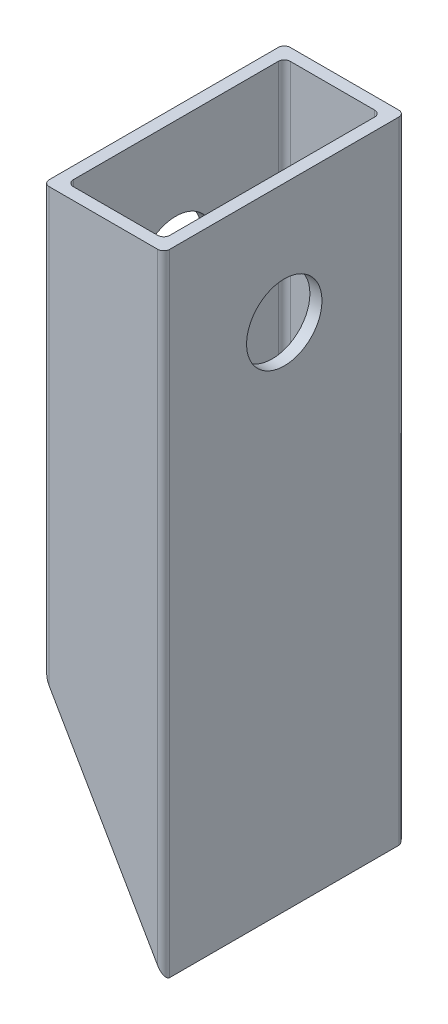
from build123d import *

# Parameters (mm, degrees)
BOSS_EXTRU_1_DEPTH      = 705
ESQUISSE3_R             = 10.125
ESQUISSE3_R_2           = 12.5
ENL_V_MAT_EXTRU_1_DEPTH = 711.651109899
ENL_V_MAT_EXTRU_2_DEPTH = 711.651109899


with BuildPart() as part:
    # Esquisse2 → Boss.-Extru.1 (new body)
    with BuildSketch(Plane(origin=(0, 0, 0), x_dir=(1, 0, 0), z_dir=(0, 1, 0))):
        with BuildLine():
            Line((2, 0), (38, 0))
            ThreePointArc((38, 0), (39.414213562, 0.585786438), (40, 2))
            Line((40, 2), (40, 78))
            ThreePointArc((40, 78), (39.414213562, 79.414213562), (38, 80))
            Line((38, 80), (2, 80))
            ThreePointArc((2, 80), (0.585786438, 79.414213562), (0, 78))
            Line((0, 78), (0, 2))
            ThreePointArc((0, 2), (0.585786438, 0.585786438), (2, 0))
        make_face()
        with BuildLine():
            Line((6, 4), (34, 4))
            ThreePointArc((34, 4), (35.414213562, 4.585786438), (36, 6))
            Line((36, 6), (36, 74))
            ThreePointArc((36, 74), (35.414213562, 75.414213562), (34, 76))
            Line((34, 76), (6, 76))
            ThreePointArc((6, 76), (4.585786438, 75.414213562), (4, 74))
            Line((4, 74), (4, 6))
            ThreePointArc((4, 6), (4.585786438, 4.585786438), (6, 4))
        make_face(mode=Mode.SUBTRACT)
    extrude(amount=BOSS_EXTRU_1_DEPTH)

    # Esquisse3 → Enlèv. mat.-Extru.1 (cut, through all)
    with BuildSketch(Plane(origin=(40, 0, 0), x_dir=(0, 0, -1), z_dir=(1, 0, 0))):
        with Locations((40, 90)):
            Circle(ESQUISSE3_R)
        with Locations((40, 665)):
            Circle(ESQUISSE3_R_2)
    extrude(amount=-ENL_V_MAT_EXTRU_1_DEPTH, mode=Mode.SUBTRACT)

    # Esquisse4 → Enlèv. mat.-Extru.2 (cut, through all)
    with BuildSketch(Plane.XY):
        Polygon((0, 565), (40, 495.717967697), (40, 0), (0, 0), align=None)
    extrude(amount=-ENL_V_MAT_EXTRU_2_DEPTH, mode=Mode.SUBTRACT)


solid = part.part
